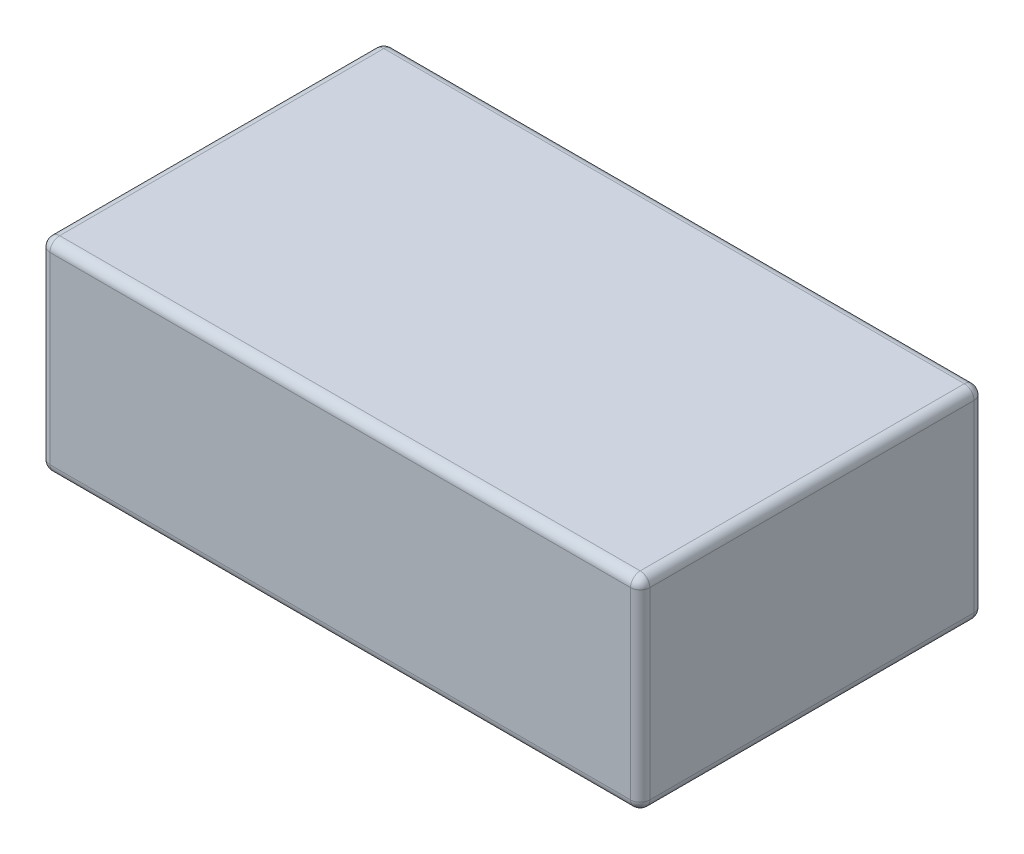
from build123d import *

# Parameters (mm, degrees)
SKETCH_1_W      = 124
SKETCH_1_H      = 71
EXTRUDE_1_DEPTH = 42
FILLET_1_R      = 2


with BuildPart() as part:
    # 草图1 → 凸台-拉伸1 (new body)
    with BuildSketch(Plane(origin=(0, 0, 0), x_dir=(1, 0, 0), z_dir=(0, 1, 0))):
        Rectangle(SKETCH_1_W, SKETCH_1_H)
    extrude(amount=EXTRUDE_1_DEPTH)

    # 圆角1
    fillet_1_edges = [part.edges().sort_by_distance(p)[0] for p in [
        (62, 42, 0),
        (0, 42, -35.5),
        (-62, 42, 0),
        (0, 0, -35.5),
        (62, 0, 0),
        (0, 0, 35.5),
        (-62, 0, 0),
        (-62, 21, -35.5),
        (62, 21, -35.5),
        (62, 21, 35.5),
        (-62, 21, 35.5),
        (0, 42, 35.5),
    ]]
    fillet(fillet_1_edges, radius=FILLET_1_R)


solid = part.part
